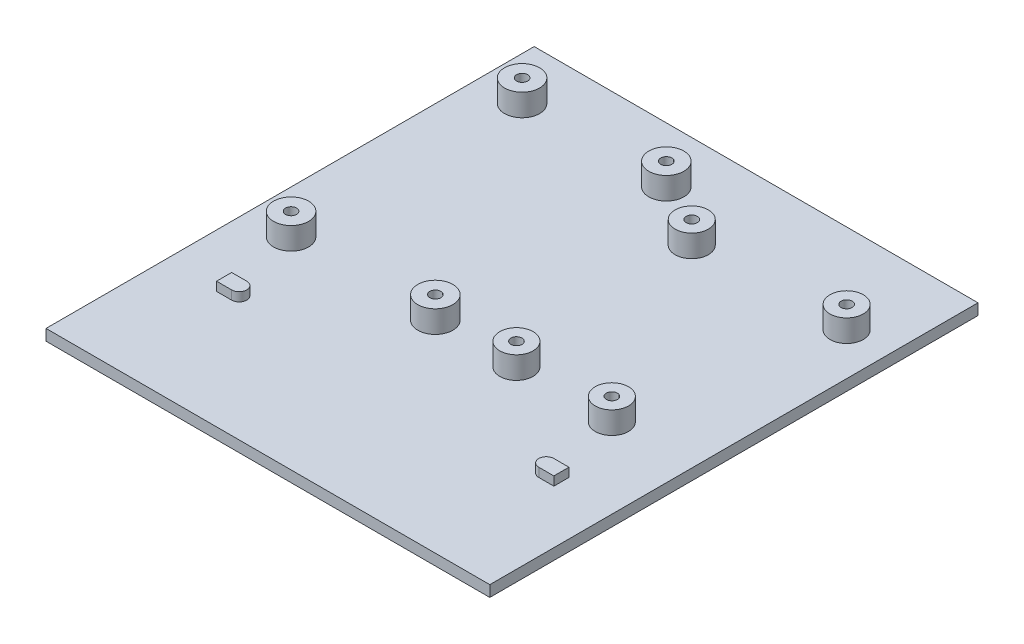
from build123d import *

# Parameters (mm, degrees)
SKETCH1_W           = 127
SKETCH1_H           = 139.7
BOSS_EXTRUDE5_DEPTH = 3.175
SKETCH2_R           = 5.0165
SKETCH2_R_2         = 1.5875
SKETCH2_R_3         = 4.7625
BOSS_EXTRUDE6_DEPTH = 6.35
CUT_EXTRUDE2_START  = -3.81
CUT_EXTRUDE2_DEPTH  = 3.81


with BuildPart() as part:
    # Sketch1 → Boss-Extrude5 (new body)
    with BuildSketch(Plane(origin=(0, 0, 0), x_dir=(1, 0, 0), z_dir=(0, 1, 0))):
        with Locations((63.5, -69.85)):
            Rectangle(SKETCH1_W, SKETCH1_H)
    extrude(amount=BOSS_EXTRUDE5_DEPTH)

    # Sketch2 → Boss-Extrude6 (add)
    # profile 1 of 10: a face of its own
    with BuildSketch(Plane(origin=(0, 3.175, 0), x_dir=(1, 0, 0), z_dir=(0, 1, 0))):
        with Locations(Location((12.3825, -15.84325, 0), (0, 0, 270))):
            Circle(SKETCH2_R)
        with Locations(Location((12.3825, -15.84325, 0), (0, 0, 270))):
            Circle(SKETCH2_R_2, mode=Mode.SUBTRACT)
    # profile 2 of 10: a face of its own
    with BuildSketch(Plane(origin=(0, 3.175, 0), x_dir=(1, 0, 0), z_dir=(0, 1, 0))):
        with Locations(Location((53.6575, -15.84325, 0), (0, 0, 270))):
            Circle(SKETCH2_R)
        with Locations(Location((53.6575, -15.84325, 0), (0, 0, 270))):
            Circle(SKETCH2_R_2, mode=Mode.SUBTRACT)
    # profile 3 of 10: a face of its own
    with BuildSketch(Plane(origin=(0, 3.175, 0), x_dir=(1, 0, 0), z_dir=(0, 1, 0))):
        with Locations(Location((71.755, -26.67, 0), (0, 0, 270))):
            Circle(SKETCH2_R_3)
        with Locations(Location((71.755, -26.67, 0), (0, 0, 270))):
            Circle(SKETCH2_R_2, mode=Mode.SUBTRACT)
    # profile 4 of 10: a face of its own
    with BuildSketch(Plane(origin=(0, 3.175, 0), x_dir=(1, 0, 0), z_dir=(0, 1, 0))):
        with Locations(Location((114.935, -25.527, 0), (0, 0, 270))):
            Circle(SKETCH2_R_3)
        with Locations(Location((114.935, -25.527, 0), (0, 0, 270))):
            Circle(SKETCH2_R_2, mode=Mode.SUBTRACT)
    # profile 5 of 10: a face of its own
    with BuildSketch(Plane(origin=(0, 3.175, 0), x_dir=(1, 0, 0), z_dir=(0, 1, 0))):
        with Locations(Location((104.14, -81.915, 0), (0, 0, 270))):
            Circle(SKETCH2_R_3)
        with Locations(Location((104.14, -81.915, 0), (0, 0, 270))):
            Circle(SKETCH2_R_2, mode=Mode.SUBTRACT)
    # profile 6 of 10: a face of its own
    with BuildSketch(Plane(origin=(0, 3.175, 0), x_dir=(1, 0, 0), z_dir=(0, 1, 0))):
        with Locations(Location((76.835, -81.915, 0), (0, 0, 270))):
            Circle(SKETCH2_R_3)
        with Locations(Location((76.835, -81.915, 0), (0, 0, 270))):
            Circle(SKETCH2_R_2, mode=Mode.SUBTRACT)
    # profile 7 of 10: a face of its own
    with BuildSketch(Plane(origin=(0, 3.175, 0), x_dir=(1, 0, 0), z_dir=(0, 1, 0))):
        with Locations(Location((53.6575, -81.94675, 0), (0, 0, 270))):
            Circle(SKETCH2_R)
        with Locations(Location((53.6575, -81.94675, 0), (0, 0, 270))):
            Circle(SKETCH2_R_2, mode=Mode.SUBTRACT)
    # profile 8 of 10: a face of its own
    with BuildSketch(Plane(origin=(0, 3.175, 0), x_dir=(1, 0, 0), z_dir=(0, 1, 0))):
        with Locations(Location((12.3825, -81.94675, 0), (0, 0, 270))):
            Circle(SKETCH2_R)
        with Locations(Location((12.3825, -81.94675, 0), (0, 0, 270))):
            Circle(SKETCH2_R_2, mode=Mode.SUBTRACT)
    # profile 9 of 10: a face of its own
    with BuildSketch(Plane(origin=(0, 3.175, 0), x_dir=(1, 0, 0), z_dir=(0, 1, 0))):
        with BuildLine():
            Line((15.24, -106.1339), (15.24, -101.8159))
            Line((15.24, -101.8159), (19.558, -101.8159))
            ThreePointArc((19.558, -101.8159), (21.717, -103.9749), (19.558, -106.1339))
            Line((19.558, -106.1339), (15.24, -106.1339))
        make_face()
    # profile 10 of 10: a face of its own
    with BuildSketch(Plane(origin=(0, 3.175, 0), x_dir=(1, 0, 0), z_dir=(0, 1, 0))):
        with BuildLine():
            Line((107.442, -101.8159), (111.76, -101.8159))
            Line((111.76, -101.8159), (111.76, -106.1339))
            Line((111.76, -106.1339), (107.442, -106.1339))
            ThreePointArc((107.442, -106.1339), (105.283, -103.9749), (107.442, -101.8159))
        make_face()
    extrude(amount=BOSS_EXTRUDE6_DEPTH)

    # Sketch3 → Cut-Extrude2 (cut)
    with BuildSketch(Plane(origin=(0, 9.525, 0), x_dir=(1, 0, 0), z_dir=(0, 1, 0)).offset(CUT_EXTRUDE2_START)):
        with BuildLine():
            Line((19.558, -101.8159), (15.24, -101.8159))
            Line((15.24, -101.8159), (15.24, -106.1339))
            Line((15.24, -106.1339), (19.558, -106.1339))
            ThreePointArc((19.558, -106.1339), (21.717, -103.9749), (19.558, -101.8159))
        make_face()
        with BuildLine():
            Line((111.76, -106.1339), (107.442, -106.1339))
            ThreePointArc((107.442, -106.1339), (105.283, -103.9749), (107.442, -101.8159))
            Line((107.442, -101.8159), (111.76, -101.8159))
            Line((111.76, -101.8159), (111.76, -106.1339))
        make_face()
    extrude(amount=CUT_EXTRUDE2_DEPTH, mode=Mode.SUBTRACT)


solid = part.part
